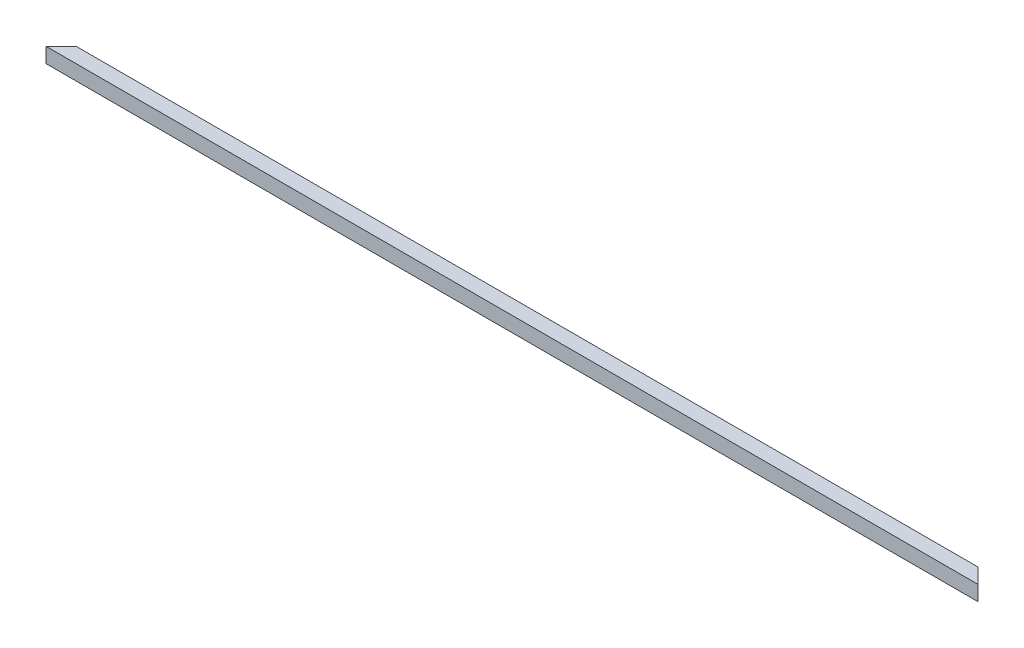
from build123d import *

# Parameters (mm, degrees)
SKETCH1_W           = 25.4
SKETCH1_H           = 25.4
SKETCH1_W_2         = 22.225
SKETCH1_H_2         = 22.225
BOSS_EXTRUDE1_DEPTH = 1574.8
CUT_EXTRUDE1_DEPTH  = 1576.056027575


with BuildPart() as part:
    # Sketch1 → Boss-Extrude1 (new body)
    with BuildSketch(Plane(origin=(0, 0, 0), x_dir=(0, 0, -1), z_dir=(1, 0, 0))):
        Rectangle(SKETCH1_W, SKETCH1_H)
        Rectangle(SKETCH1_W_2, SKETCH1_H_2, mode=Mode.SUBTRACT)
    extrude(amount=BOSS_EXTRUDE1_DEPTH)

    # Sketch2 → Cut-Extrude1 (cut, through all)
    with BuildSketch(Plane(origin=(0, 12.7, 0), x_dir=(1, 0, 0), z_dir=(0, 1, 0))):
        Polygon((0, -12.7), (25.4, 12.7), (0, 12.7), align=None)
    cut_extrude1 = extrude(amount=-CUT_EXTRUDE1_DEPTH, mode=Mode.SUBTRACT)

    # Mirror1: Cut-Extrude1 across plane
    add(cut_extrude1.mirror(Plane(origin=(787.4, 0, 0), x_dir=(0, 0, 1), z_dir=(1, 0, 0))), mode=Mode.SUBTRACT)


solid = part.part
